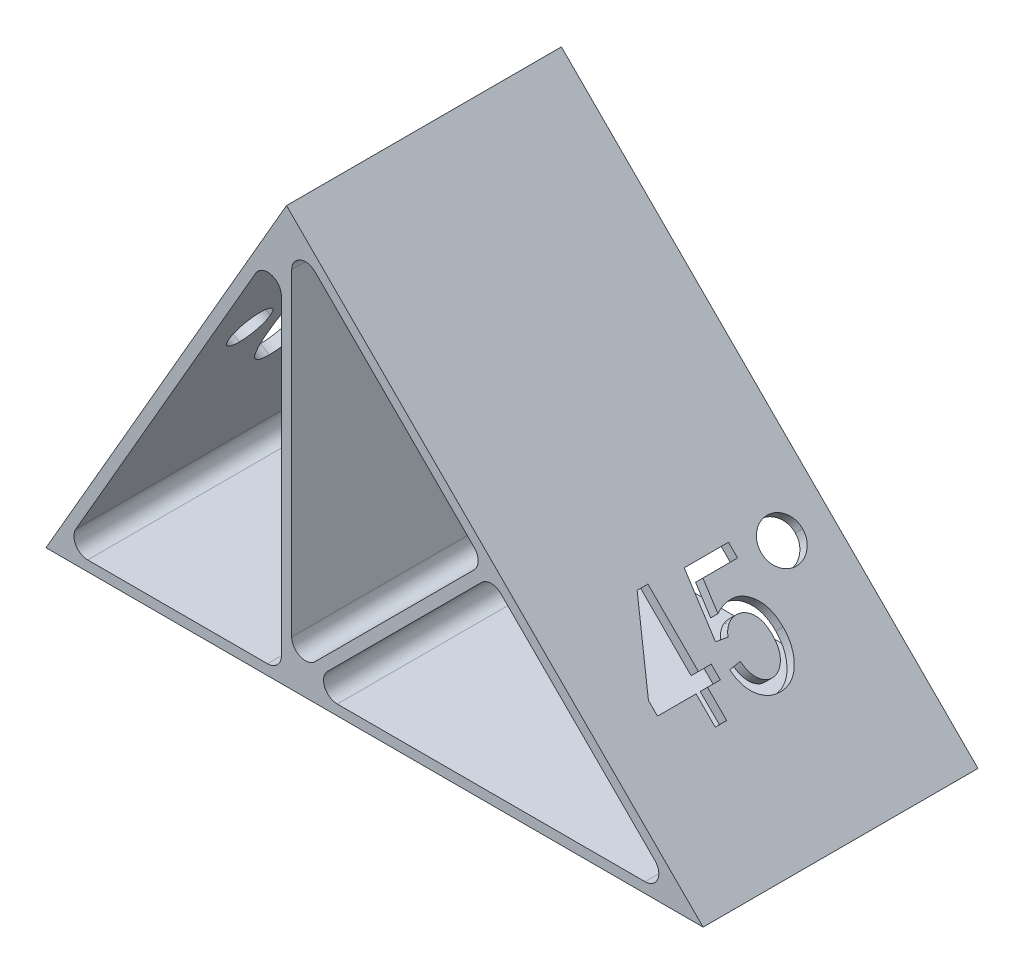
from build123d import *

# Parameters (mm, degrees)
BOSS_EXTRU_1_DEPTH      = 10
ENL_V_MAT_EXTRU_1_REACH = 39.364
ENL_V_MAT_EXTRU_2_DEPTH = 0.75
ENL_V_MAT_EXTRU_3_REACH = 52.035
CONG_1_R                = 1


with BuildPart() as part:
    # Esquisse1 → Boss.-Extru.1 (new, symmetric)
    with BuildSketch(Plane.XY):
        Polygon((-17.5, 0), (0, 30.310889132), (30.310889132, 0), align=None)
        Polygon((-16.200961894, 0.75), (-0.375, 28.16137008), (-0.375, 0.75), align=None, mode=Mode.SUBTRACT)
        Polygon((0.375, 28.875228961), (14.359949437, 14.890279523), (0.375, 0.905330086), align=None, mode=Mode.SUBTRACT)
        Polygon((28.500228961, 0.75), (1.280330086, 0.75), (14.890279523, 14.359949437), align=None, mode=Mode.SUBTRACT)
    extrude(amount=BOSS_EXTRU_1_DEPTH, both=True)

    # Esquisse2 → Enlèv. mat.-Extru.1 (cut, up to next)
    with BuildSketch(Plane(origin=(15.155444566, 15.155444566, 0), x_dir=(0, 0, -1), z_dir=(0.7071067811865437, 0.7071067811865513, 0)), mode=Mode.PRIVATE) as enl_v_mat_extru_1_sk1:
        Polygon((-3.035466988, -12.833518709), (-3.035466988, -10.859492735), (-5.840661794, -10.859492735), (-5.840661794, -9.9244278), (-2.988389066, -4.729622605), (-2.204298157, -4.729622605), (-2.204298157, -9.9244278), (-1.269233222, -9.9244278), (-1.269233222, -10.859492735), (-2.204298157, -10.859492735), (-2.204298157, -12.833518709), align=None)
        Polygon((-3.035466988, -9.9244278), (-3.035466988, -6.30916806), (-5.020856599, -9.9244278), align=None, mode=Mode.SUBTRACT)
    enl_v_mat_extru_1_tool1 = extrude(enl_v_mat_extru_1_sk1.sketch, amount=-ENL_V_MAT_EXTRU_1_REACH, mode=Mode.PRIVATE) & part.part
    # Esquisse2 → Enlèv. mat.-Extru.1 (cut, up to next)
    with BuildSketch(Plane(origin=(15.155444566, 15.155444566, 0), x_dir=(0, 0, -1), z_dir=(0.7071067811865437, 0.7071067811865513, 0)), mode=Mode.PRIVATE) as enl_v_mat_extru_1_sk2:
        with BuildLine():
            Line((-0.438064391, -10.651700527), (0.39310444, -10.547804423))
            add(Edge.make_bspline(
                [(0.39310444, -10.547804423), (0.401540786, -10.611244993), (0.41798176, -10.734879659), (0.454595352, -10.912857598), (0.494979853, -11.079626019), (0.5489008, -11.23190873), (0.603602516, -11.374599866), (0.671225322, -11.502446684), (0.743605704, -11.619229781), (0.825852321, -11.721144257), (0.911263998, -11.812845156), (1.002246834, -11.890432094), (1.096419219, -11.956504002), (1.193187466, -12.012068952), (1.294570265, -12.054769031), (1.399421614, -12.083670616), (1.50716682, -12.102277889), (1.58025807, -12.104915424), (1.617130414, -12.106245982)],
                knots=[0, 0, 0, 0, 1.411223046, 2.750228965, 4.006672634, 5.191927097, 6.311278306, 7.373684419, 8.377051755, 9.337097037, 10.257438676, 11.13782359, 11.969011532, 12.792190119, 13.594685164, 14.388253401, 15.186922146, 16, 16, 16, 16], degree=3))
            add(Edge.make_bspline(
                [(1.617130414, -12.106245982), (1.663241583, -12.104738429), (1.754496571, -12.101754949), (1.888600595, -12.076305406), (2.018355271, -12.0361345), (2.141764485, -11.97629319), (2.261368004, -11.902969254), (2.376021974, -11.812808273), (2.483932026, -11.704814401), (2.587910203, -11.583325277), (2.684117491, -11.448108857), (2.764474723, -11.29719988), (2.834348787, -11.135926597), (2.893739442, -10.963193876), (2.93664195, -10.777539332), (2.966767804, -10.580501216), (2.987185691, -10.371821125), (2.989379206, -10.228591283), (2.990507038, -10.154947281)],
                knots=[0, 0, 0, 0, 0.833557162, 1.649627401, 2.46080936, 3.284070299, 4.12358479, 4.995082037, 5.915776015, 6.88098611, 7.885890802, 8.910954604, 9.967600199, 11.063514457, 12.210406555, 13.409466691, 14.668034258, 16, 16, 16, 16], degree=3))
            add(Edge.make_bspline(
                [(2.990507038, -10.154947281), (2.989220567, -10.086181722), (2.986714043, -9.952200756), (2.968427838, -9.757003635), (2.940191977, -9.573366447), (2.898125579, -9.401548775), (2.842067508, -9.242525328), (2.77831427, -9.093570358), (2.69957344, -8.957526921), (2.608469938, -8.835089425), (2.510443521, -8.72430933), (2.403421006, -8.629457724), (2.291577199, -8.548229084), (2.173769227, -8.47963336), (2.047769756, -8.430803823), (1.917271225, -8.391828635), (1.779560938, -8.371388618), (1.685909669, -8.367808688), (1.63823431, -8.365986242)],
                knots=[0, 0, 0, 0, 1.312040837, 2.556345105, 3.737883698, 4.854849349, 5.925960309, 6.952388988, 7.9424386, 8.917239489, 9.860521384, 10.760061641, 11.639947922, 12.495504232, 13.352616949, 14.212152034, 15.089854369, 16, 16, 16, 16], degree=3))
            add(Edge.make_bspline(
                [(1.63823431, -8.365986242), (1.580665066, -8.36848876), (1.465820267, -8.37348103), (1.296227569, -8.41393753), (1.133343402, -8.481658501), (0.97752942, -8.572598848), (0.832565861, -8.686097808), (0.703663334, -8.823073239), (0.588722578, -8.97919282), (0.527970347, -9.095604058), (0.497000544, -9.154947281)],
                knots=[0, 0, 0, 0, 0.943378558, 1.881944462, 2.841095037, 3.827409543, 4.832274565, 5.849176661, 6.903569879, 8, 8, 8, 8], degree=3))
            Line((0.497000544, -9.154947281), (-0.334168287, -9.036440787))
            Line((-0.334168287, -9.036440787), (0.289208336, -4.937414813))
            Line((0.289208336, -4.937414813), (3.509987557, -4.937414813))
            Line((3.509987557, -4.937414813), (3.509987557, -5.872479748))
            Line((3.509987557, -5.872479748), (0.985636908, -5.872479748))
            Line((0.985636908, -5.872479748), (0.685312232, -7.848129099))
            add(Edge.make_bspline(
                [(0.685312232, -7.848129099), (0.778945424, -7.800244303), (0.964253106, -7.705476409), (1.2591026, -7.606781888), (1.562116088, -7.545877964), (1.767278978, -7.538516622), (1.870377167, -7.53481741)],
                knots=[0, 0, 0, 0, 1.017619267, 2.013951072, 3.001973272, 4, 4, 4, 4], degree=3))
            add(Edge.make_bspline(
                [(1.870377167, -7.53481741), (1.934907813, -7.537092862), (2.063160241, -7.541615245), (2.251688716, -7.575030612), (2.43401367, -7.628519779), (2.609285031, -7.706120608), (2.777594632, -7.805426445), (2.940201972, -7.925665071), (3.096319989, -8.067057918), (3.242621136, -8.231012897), (3.378986532, -8.411379582), (3.498041125, -8.609413218), (3.599083725, -8.822438479), (3.67926162, -9.051473946), (3.74530827, -9.294209042), (3.789911886, -9.552913673), (3.815556193, -9.826502702), (3.81960344, -10.013658122), (3.821675869, -10.109492735)],
                knots=[0, 0, 0, 0, 0.861018809, 1.711245113, 2.547675859, 3.391805506, 4.262674834, 5.151129072, 6.086914488, 7.068866089, 8.080081396, 9.100796714, 10.1476286, 11.221399762, 12.335728169, 13.501851446, 14.720800604, 16, 16, 16, 16], degree=3))
            add(Edge.make_bspline(
                [(3.821675869, -10.109492735), (3.819699814, -10.204792093), (3.815806664, -10.392547364), (3.788198123, -10.668842982), (3.740811957, -10.934598423), (3.675807809, -11.190184564), (3.593576998, -11.436061403), (3.49056137, -11.671124014), (3.368501786, -11.895136274), (3.230094817, -12.107241468), (3.075799506, -12.300806895), (2.907883631, -12.472300755), (2.725056582, -12.615390111), (2.530308029, -12.733953669), (2.322303937, -12.825519443), (2.101359807, -12.890341469), (1.867501078, -12.930385958), (1.707119662, -12.935039333), (1.625247297, -12.937414813)],
                knots=[0, 0, 0, 0, 1.144340564, 2.254537473, 3.330370625, 4.383172833, 5.418849903, 6.440219285, 7.460844228, 8.47914966, 9.47775429, 10.428908251, 11.354479858, 12.258284926, 13.160219244, 14.07516849, 15.0174017, 16, 16, 16, 16], degree=3))
            add(Edge.make_bspline(
                [(1.625247297, -12.937414813), (1.556975889, -12.935459693), (1.422573283, -12.931610744), (1.224999771, -12.903660176), (1.035584622, -12.856570999), (0.854207595, -12.789741451), (0.681673325, -12.702808127), (0.516334847, -12.59858834), (0.360538063, -12.474093537), (0.212485987, -12.333044508), (0.076447528, -12.174662086), (-0.043886577, -11.999472565), (-0.149949849, -11.810666676), (-0.239338543, -11.606684452), (-0.311719311, -11.388446353), (-0.370263675, -11.15625981), (-0.414764071, -10.909503111), (-0.430175544, -10.738985392), (-0.438064391, -10.651700527)],
                knots=[0, 0, 0, 0, 0.958587677, 1.88712499, 2.795765124, 3.694982091, 4.595578744, 5.504218877, 6.434682167, 7.391400486, 8.372260331, 9.360890354, 10.371359061, 11.409147611, 12.483330096, 13.596558593, 14.769722824, 16, 16, 16, 16], degree=3))
        make_face()
    enl_v_mat_extru_1_tool2 = extrude(enl_v_mat_extru_1_sk2.sketch, amount=-ENL_V_MAT_EXTRU_1_REACH, mode=Mode.PRIVATE) & part.part
    # Esquisse2 → Enlèv. mat.-Extru.1 (cut, up to next)
    with BuildSketch(Plane(origin=(15.155444566, 15.155444566, 0), x_dir=(0, 0, -1), z_dir=(0.7071067811865437, 0.7071067811865513, 0)), mode=Mode.PRIVATE) as enl_v_mat_extru_1_sk3:
        with BuildLine():
            add(Edge.make_bspline(
                [(4.964533012, -6.232869358), (4.965598539, -6.181921073), (4.967705118, -6.081194811), (4.989912161, -5.933436486), (5.023477871, -5.790675845), (5.072761029, -5.654423413), (5.134226159, -5.523285951), (5.211881195, -5.399632482), (5.30143589, -5.280150337), (5.404552661, -5.167998199), (5.516790336, -5.065089535), (5.63588893, -4.974544908), (5.761681758, -4.900037007), (5.892069798, -4.838061676), (6.027660145, -4.788276001), (6.169468941, -4.755231969), (6.316624792, -4.732672893), (6.416825938, -4.730650847), (6.467779765, -4.729622605)],
                knots=[0, 0, 0, 0, 1.033790096, 2.043833458, 3.027228292, 4.007302706, 4.980454208, 5.962313206, 6.966602655, 8.008767425, 9.050932194, 10.055221643, 11.040762626, 12.013914127, 12.98364789, 13.967042724, 14.966209904, 16, 16, 16, 16], degree=3))
            add(Edge.make_bspline(
                [(6.467779765, -4.729622605), (6.519268786, -4.730685769), (6.621071626, -4.732787831), (6.770439295, -4.755033285), (6.91434158, -4.788340094), (7.051202254, -4.837690728), (7.181978917, -4.900078532), (7.307793949, -4.974532187), (7.426875972, -5.06509819), (7.539158797, -5.167976064), (7.642112995, -5.280228615), (7.732076655, -5.399129951), (7.807528034, -5.523798875), (7.86940498, -5.654354186), (7.918544728, -5.790694495), (7.952149243, -5.933431358), (7.974345745, -6.081196143), (7.976453767, -6.18192152), (7.977520025, -6.232869358)],
                knots=[0, 0, 0, 0, 1.041641648, 2.059508501, 3.050612989, 4.027754557, 4.997993928, 5.980585705, 6.981869844, 8.020915963, 9.059962082, 10.061246221, 11.034449671, 12.004689042, 12.981830609, 13.96228266, 14.969303494, 16, 16, 16, 16], degree=3))
            add(Edge.make_bspline(
                [(7.977520025, -6.232869358), (7.976464278, -6.283819122), (7.974377036, -6.384548304), (7.951949883, -6.532806724), (7.918725667, -6.676146906), (7.869711673, -6.813412166), (7.805442754, -6.943945449), (7.728701488, -7.06935938), (7.639467639, -7.190297866), (7.535808967, -7.30253621), (7.423727049, -7.405653512), (7.304045489, -7.495790203), (7.17924036, -7.572455191), (7.047886514, -7.634424342), (6.911115825, -7.683939657), (6.767701164, -7.717005534), (6.619462839, -7.739475407), (6.518730915, -7.74155682), (6.467779765, -7.742609618)],
                knots=[0, 0, 0, 0, 1.029210758, 2.034779973, 3.024455786, 4.000188805, 4.973773238, 5.960603497, 6.969202704, 8.00675104, 9.044299375, 10.044140164, 11.030970423, 11.999811195, 12.975544214, 13.965220027, 14.970789242, 16, 16, 16, 16], degree=3))
            add(Edge.make_bspline(
                [(6.467779765, -7.742609618), (6.416825939, -7.741581376), (6.316624794, -7.739559329), (6.169468934, -7.717000258), (6.02766017, -7.683956208), (5.892069707, -7.634170603), (5.761682101, -7.572195005), (5.635887622, -7.49768812), (5.516795398, -7.407139573), (5.404532987, -7.304246133), (5.301508095, -7.192037448), (5.211347184, -7.072388627), (5.134689929, -6.947574777), (5.07271351, -6.816223955), (5.023219858, -6.679449687), (4.989952153, -6.535523777), (4.96769604, -6.386162547), (4.965595437, -6.284358826), (4.964533012, -6.232869358)],
                knots=[0, 0, 0, 0, 1.031089736, 2.027646995, 3.008473106, 3.97567383, 4.946283365, 5.929250019, 6.930916166, 7.970358701, 9.009801235, 10.011467382, 11.000099246, 11.970708781, 12.948223146, 13.939705759, 14.957960947, 16, 16, 16, 16], degree=3))
        make_face()
        with BuildLine():
            add(Edge.make_bspline(
                [(5.691805739, -6.236116112), (5.694538659, -6.28838044), (5.699872406, -6.390382961), (5.744342758, -6.53742623), (5.816539964, -6.672613121), (5.917338494, -6.790998219), (6.036633898, -6.890524495), (6.171294779, -6.962862532), (6.318394894, -7.007253724), (6.420389581, -7.012598381), (6.472649895, -7.015336891)],
                knots=[0, 0, 0, 0, 1.021783983, 1.994181231, 2.980339501, 4.003386608, 5.019660499, 6.005818769, 6.978216017, 8, 8, 8, 8], degree=3))
            add(Edge.make_bspline(
                [(6.472649895, -7.015336891), (6.524350395, -7.012528939), (6.625765841, -7.007020875), (6.772065296, -6.963272843), (6.905664334, -6.88998622), (7.024748198, -6.791061835), (7.125504391, -6.672596712), (7.197712518, -6.537430463), (7.24218004, -6.390381847), (7.247514178, -6.288380062), (7.250247297, -6.236116112)],
                knots=[0, 0, 0, 0, 1.013752191, 1.988571289, 2.96783755, 3.98664257, 5.012237674, 6.000852067, 6.975671165, 8, 8, 8, 8], degree=3))
            add(Edge.make_bspline(
                [(7.250247297, -6.236116112), (7.24749184, -6.183862879), (7.242114107, -6.081882012), (7.198101051, -5.935142184), (7.125040527, -5.800922432), (7.024277679, -5.682864816), (6.906220313, -5.582102515), (6.772000134, -5.509040139), (6.62578286, -5.465190256), (6.524356142, -5.459696162), (6.472649895, -5.456895333)],
                knots=[0, 0, 0, 0, 1.024656475, 1.999787376, 2.979366864, 4.005290014, 5.031213163, 6.010792651, 6.985923552, 8, 8, 8, 8], degree=3))
            add(Edge.make_bspline(
                [(6.472649895, -5.456895333), (6.420383755, -5.459626627), (6.318377697, -5.464957203), (6.171360087, -5.509450568), (6.036074165, -5.581558954), (5.917808804, -5.682928239), (5.817003999, -5.800906295), (5.743954195, -5.935146375), (5.699938345, -6.081880904), (5.694560999, -6.183862503), (5.691805739, -6.236116112)],
                knots=[0, 0, 0, 0, 1.022109997, 1.994817501, 2.981290418, 4.004663941, 5.028037464, 6.005182499, 6.977890003, 8, 8, 8, 8], degree=3))
        make_face(mode=Mode.SUBTRACT)
    enl_v_mat_extru_1_tool3 = extrude(enl_v_mat_extru_1_sk3.sketch, amount=-ENL_V_MAT_EXTRU_1_REACH, mode=Mode.PRIVATE) & part.part
    add(enl_v_mat_extru_1_tool1.solids().sort_by_distance((23.532189, 6.7787, 2.942423))[0], mode=Mode.SUBTRACT)
    add(enl_v_mat_extru_1_tool2.solids().sort_by_distance((22.714195, 7.596695, 0.011238))[0], mode=Mode.SUBTRACT)
    add(enl_v_mat_extru_1_tool3.solids().sort_by_distance((18.832826, 11.478063, -5.435305))[0], mode=Mode.SUBTRACT)


with BuildPart() as enl_v_mat_extru_1_piece_1:
    # of the separate pieces the step leaves, piece 1, a body of its own (enl_v_mat_extru_1_pieces)
    add(part.part.solids().sort_by_distance((-17.5, 0, -10))[0])

    # Esquisse4 → Enlèv. mat.-Extru.3 (cut, up to next)
    with BuildSketch(Plane(origin=(-13.125, 7.577722283, 0), x_dir=(0, 0, 1), z_dir=(-0.866025403784436, 0.5000000000000043, 0)), mode=Mode.PRIVATE) as enl_v_mat_extru_3_sk1:
        with BuildLine():
            Line((-1.749093416, 11.311725682), (-2.580262248, 11.207829578))
            add(Edge.make_bspline(
                [(-2.580262248, 11.207829578), (-2.599474661, 11.302491044), (-2.635450712, 11.479748623), (-2.713482354, 11.719876478), (-2.800424023, 11.920646506), (-2.880824235, 12.027177691), (-2.917924585, 12.076336071)],
                knots=[0, 0, 0, 0, 1.230211225, 2.30362229, 3.217213433, 4, 4, 4, 4], degree=3))
            add(Edge.make_bspline(
                [(-2.917924585, 12.076336071), (-2.944904671, 12.106704889), (-2.997365306, 12.165754645), (-3.084555103, 12.242245607), (-3.174324139, 12.308168311), (-3.268728071, 12.362448188), (-3.368879741, 12.403030907), (-3.472914748, 12.432078362), (-3.58069551, 12.450596584), (-3.653781943, 12.453246182), (-3.690651858, 12.454582825)],
                knots=[0, 0, 0, 0, 1.09495211, 2.12904747, 3.12182315, 4.09596367, 5.058329339, 6.028853599, 7.005615717, 8, 8, 8, 8], degree=3))
            add(Edge.make_bspline(
                [(-3.690651858, 12.454582825), (-3.747769397, 12.452463596), (-3.860930736, 12.448264977), (-4.025151593, 12.402999689), (-4.181489627, 12.335031619), (-4.327758136, 12.236730561), (-4.464236112, 12.111573044), (-4.593828012, 11.960739631), (-4.711659863, 11.780767959), (-4.780063271, 11.648433265), (-4.815651858, 11.579582825)],
                knots=[0, 0, 0, 0, 0.906800098, 1.796553483, 2.691003266, 3.610512055, 4.585978966, 5.630213089, 6.767058994, 8, 8, 8, 8], degree=3))
            add(Edge.make_bspline(
                [(-4.815651858, 11.579582825), (-4.845520804, 11.513496565), (-4.907618995, 11.376101789), (-4.980438501, 11.152202267), (-5.044429608, 10.906806047), (-5.092411171, 10.637770428), (-5.136034204, 10.347882916), (-5.163847702, 10.034563334), (-5.182025772, 9.699388983), (-5.184505096, 9.468137443), (-5.185781728, 9.349063344)],
                knots=[0, 0, 0, 0, 0.763508889, 1.587351645, 2.476402758, 3.433472996, 4.464603951, 5.563935012, 6.745641893, 8, 8, 8, 8], degree=3))
            add(Edge.make_bspline(
                [(-5.185781728, 9.349063344), (-5.138719979, 9.430089469), (-5.047147002, 9.587750489), (-4.876506983, 9.79432601), (-4.693545092, 9.974357631), (-4.490375877, 10.119016612), (-4.27591802, 10.232514245), (-4.054348507, 10.316624306), (-3.825515276, 10.367369795), (-3.670878615, 10.373555468), (-3.593249261, 10.376660747)],
                knots=[0, 0, 0, 0, 1.127907175, 2.194687167, 3.21896757, 4.214740698, 5.189497801, 6.137088422, 7.064797308, 8, 8, 8, 8], degree=3))
            add(Edge.make_bspline(
                [(-3.593249261, 10.376660747), (-3.528720509, 10.374416079), (-3.401538479, 10.369991983), (-3.213861402, 10.336511409), (-3.033193306, 10.280834394), (-2.857857276, 10.204262701), (-2.689596095, 10.103564459), (-2.527215362, 9.981915989), (-2.372752689, 9.836802328), (-2.223503485, 9.674550604), (-2.088017062, 9.491782551), (-1.969184547, 9.292673794), (-1.867782624, 9.079310018), (-1.787301077, 8.849802193), (-1.722042418, 8.606878598), (-1.676743316, 8.348326524), (-1.651362398, 8.075226186), (-1.647285119, 7.888076724), (-1.645197312, 7.792245162)],
                knots=[0, 0, 0, 0, 0.860357646, 1.695709716, 2.533583491, 3.377064945, 4.241047709, 5.143225219, 6.077846286, 7.063889573, 8.080111547, 9.106229702, 10.152257742, 11.225204373, 12.345649275, 13.503769734, 14.721782881, 16, 16, 16, 16], degree=3))
            add(Edge.make_bspline(
                [(-1.645197312, 7.792245162), (-1.648511599, 7.662194459), (-1.655003931, 7.407439121), (-1.709418579, 7.034439811), (-1.801029882, 6.680611955), (-1.904866451, 6.400189234), (-2.004612035, 6.189991147), (-2.084478542, 6.043224234), (-2.168562242, 5.906887544), (-2.257587911, 5.780747331), (-2.354262249, 5.66774568), (-2.453285193, 5.562361007), (-2.558628991, 5.468338627), (-2.704634611, 5.359215477), (-2.896689064, 5.246453708), (-3.14202934, 5.149895918), (-3.398721689, 5.088862694), (-3.574516193, 5.08161149), (-3.663054455, 5.077959448)],
                knots=[0, 0, 0, 0, 1.657459496, 3.246784879, 4.79287916, 6.310074839, 7.050696599, 7.757650882, 8.439205885, 9.092012499, 9.723586031, 10.333538589, 10.934530017, 11.52093132, 12.655638276, 13.761218907, 14.872446044, 16, 16, 16, 16], degree=3))
            add(Edge.make_bspline(
                [(-3.663054455, 5.077959448), (-3.742805171, 5.080746558), (-3.899663268, 5.086228399), (-4.129188404, 5.130292871), (-4.348724443, 5.199248231), (-4.555824556, 5.300770004), (-4.755018847, 5.425650265), (-4.939377991, 5.583675137), (-5.114491942, 5.767447358), (-5.279720531, 5.978971099), (-5.428317881, 6.225487195), (-5.55797002, 6.507907077), (-5.666288794, 6.828484387), (-5.751636718, 7.186454704), (-5.82164277, 7.581004491), (-5.870858838, 8.012517824), (-5.899830505, 8.481777937), (-5.903191391, 8.806812105), (-5.904937572, 8.975686721)],
                knots=[0, 0, 0, 0, 0.760819453, 1.496421576, 2.223429687, 2.951263266, 3.692179274, 4.462099387, 5.262291211, 6.1127328, 7.019077074, 8.003719522, 9.073773746, 10.244022616, 11.513769144, 12.897217303, 14.387919526, 16, 16, 16, 16], degree=3))
            add(Edge.make_bspline(
                [(-5.904937572, 8.975686721), (-5.903400591, 9.162968288), (-5.900439834, 9.523737203), (-5.868658216, 10.04419912), (-5.820569266, 10.522939571), (-5.748949974, 10.959773351), (-5.660082235, 11.355404642), (-5.548261275, 11.708981541), (-5.418470464, 12.022050107), (-5.264057828, 12.292592201), (-5.093824228, 12.526108401), (-4.913429248, 12.728677214), (-4.722384456, 12.901789661), (-4.518619574, 13.042945838), (-4.301598375, 13.150614338), (-4.074527007, 13.229958169), (-3.834803878, 13.275898665), (-3.671362447, 13.28243367), (-3.588379131, 13.285751656)],
                knots=[0, 0, 0, 0, 1.648816343, 3.176189159, 4.589499976, 5.883521052, 7.071677735, 8.156616623, 9.145117633, 10.049911772, 10.892392766, 11.685345428, 12.434380955, 13.15730553, 13.86047472, 14.561137348, 15.269453316, 16, 16, 16, 16], degree=3))
            add(Edge.make_bspline(
                [(-3.588379131, 13.285751656), (-3.528259541, 13.284036265), (-3.409752082, 13.280654896), (-3.235364631, 13.258574465), (-3.069356402, 13.217030195), (-2.910185273, 13.162020414), (-2.759368206, 13.089949743), (-2.614586255, 13.004058207), (-2.480280214, 12.898445852), (-2.351718612, 12.780474648), (-2.232769243, 12.647377667), (-2.127026964, 12.498239714), (-2.033253134, 12.335408618), (-1.949342555, 12.158939424), (-1.880391843, 11.967306136), (-1.824022033, 11.761436688), (-1.777686845, 11.541994498), (-1.758791532, 11.389826615), (-1.749093416, 11.311725682)],
                knots=[0, 0, 0, 0, 0.965625992, 1.903437499, 2.816107718, 3.709373219, 4.603483816, 5.496241877, 6.407089735, 7.341876361, 8.295975248, 9.267838192, 10.27248647, 11.310449055, 12.401896837, 13.538363143, 14.736552469, 16, 16, 16, 16], degree=3))
        make_face()
        with BuildLine():
            add(Edge.make_bspline(
                [(-5.073768741, 7.823089318), (-5.072581993, 7.75269838), (-5.070267602, 7.615422231), (-5.050493577, 7.414653036), (-5.017853329, 7.224954245), (-4.975038413, 7.044635593), (-4.915791186, 6.876264592), (-4.846458456, 6.716752551), (-4.761515458, 6.569500359), (-4.666049194, 6.43298783), (-4.561767686, 6.311044852), (-4.451739747, 6.204305948), (-4.338971993, 6.112681501), (-4.220148826, 6.039157312), (-4.098422513, 5.979226174), (-3.970754178, 5.93931716), (-3.839949519, 5.913688115), (-3.751377129, 5.910652915), (-3.706885624, 5.909128279)],
                knots=[0, 0, 0, 0, 1.295936842, 2.527331243, 3.710032566, 4.838610101, 5.935196688, 6.992417297, 8.036740745, 9.059547266, 10.056000021, 10.986130286, 11.879343137, 12.725347321, 13.554280309, 14.370418864, 15.181432095, 16, 16, 16, 16], degree=3))
            add(Edge.make_bspline(
                [(-3.706885624, 5.909128279), (-3.66729144, 5.910834184), (-3.588538082, 5.91422725), (-3.472397405, 5.937045713), (-3.360639907, 5.977556484), (-3.250971114, 6.030852216), (-3.145645816, 6.101955774), (-3.042291896, 6.186225909), (-2.945671222, 6.289003845), (-2.849200516, 6.402619159), (-2.762922509, 6.532826783), (-2.683536076, 6.673331987), (-2.621762348, 6.828092421), (-2.566836124, 6.991852771), (-2.527812345, 7.168910867), (-2.495675109, 7.356148779), (-2.480881357, 7.556082064), (-2.477901323, 7.692663683), (-2.476366144, 7.763024383)],
                knots=[0, 0, 0, 0, 0.772594522, 1.536700729, 2.298102904, 3.086693685, 3.909598938, 4.772126543, 5.683120767, 6.657848237, 7.676972593, 8.726121203, 9.800678132, 10.92259173, 12.09308983, 13.334225679, 14.626713094, 16, 16, 16, 16], degree=3))
            add(Edge.make_bspline(
                [(-2.476366144, 7.763024383), (-2.477844316, 7.831771076), (-2.480711739, 7.965128965), (-2.496255128, 8.16000308), (-2.525675815, 8.34272754), (-2.565109478, 8.514286427), (-2.619965978, 8.672161945), (-2.682350258, 8.819875064), (-2.759287061, 8.955014936), (-2.846860714, 9.07799886), (-2.941742312, 9.188139834), (-3.043865539, 9.28344526), (-3.150033636, 9.364784756), (-3.262633311, 9.430495566), (-3.379172389, 9.483499152), (-3.502986069, 9.518310175), (-3.630706262, 9.542686016), (-3.718132286, 9.544553268), (-3.762080429, 9.545491916)],
                knots=[0, 0, 0, 0, 1.343777819, 2.606719898, 3.816838752, 4.958326899, 6.041908764, 7.079242616, 8.08798765, 9.073968097, 10.026073332, 10.923948235, 11.799625043, 12.633965371, 13.467232591, 14.293828985, 15.142325764, 16, 16, 16, 16], degree=3))
            add(Edge.make_bspline(
                [(-3.762080429, 9.545491916), (-3.805495132, 9.544592079), (-3.891328568, 9.54281305), (-4.016831077, 9.51810742), (-4.138984463, 9.483282765), (-4.255711121, 9.429762126), (-4.370047871, 9.365169789), (-4.479924356, 9.284929685), (-4.582945628, 9.187766337), (-4.683887768, 9.080068335), (-4.775830038, 8.959143113), (-4.855830151, 8.826917427), (-4.922262666, 8.684547174), (-4.977730403, 8.532494368), (-5.021747823, 8.369662387), (-5.051910757, 8.196314857), (-5.069911997, 8.012863949), (-5.072459227, 7.887525178), (-5.073768741, 7.823089318)],
                knots=[0, 0, 0, 0, 0.863470541, 1.707132358, 2.539352989, 3.38871181, 4.257816365, 5.15261427, 6.090962397, 7.075009843, 8.09049846, 9.111009759, 10.147788812, 11.215218178, 12.331811356, 13.503305971, 14.716465586, 16, 16, 16, 16], degree=3))
        make_face(mode=Mode.SUBTRACT)
    enl_v_mat_extru_3_tool1 = extrude(enl_v_mat_extru_3_sk1.sketch, amount=-ENL_V_MAT_EXTRU_3_REACH, mode=Mode.PRIVATE) & enl_v_mat_extru_1_piece_1.part
    # Esquisse4 → Enlèv. mat.-Extru.3 (cut, up to next)
    with BuildSketch(Plane(origin=(-13.125, 7.577722283, 0), x_dir=(0, 0, 1), z_dir=(-0.866025403784436, 0.5000000000000043, 0)), mode=Mode.PRIVATE) as enl_v_mat_extru_3_sk2:
        with BuildLine():
            add(Edge.make_bspline(
                [(-0.814028481, 9.178608799), (-0.812708613, 9.342065908), (-0.810145747, 9.659460303), (-0.783659071, 10.119804937), (-0.741881743, 10.549869098), (-0.685070215, 10.949076117), (-0.608182504, 11.31748593), (-0.517639543, 11.655689594), (-0.40643473, 11.962611588), (-0.281266847, 12.239567976), (-0.137728068, 12.485012311), (0.020517361, 12.699788021), (0.198163584, 12.880409301), (0.390312211, 13.030602929), (0.600785795, 13.145024183), (0.826588627, 13.22725641), (1.068555429, 13.276878689), (1.235520989, 13.282753932), (1.320711778, 13.285751656)],
                knots=[0, 0, 0, 0, 1.522295809, 2.955932353, 4.292935845, 5.545987552, 6.709403679, 7.796379217, 8.803980711, 9.746667296, 10.623167879, 11.447716403, 12.224665142, 12.975696349, 13.710987297, 14.4460191, 15.207112772, 16, 16, 16, 16], degree=3))
            add(Edge.make_bspline(
                [(1.320711778, 13.285751656), (1.396630379, 13.283316236), (1.545717135, 13.278533629), (1.763272423, 13.239093562), (1.967897228, 13.171996777), (2.159746109, 13.078752233), (2.338236304, 12.958365136), (2.505123929, 12.812802113), (2.658580167, 12.639128306), (2.747439772, 12.508658446), (2.793114376, 12.441595812)],
                knots=[0, 0, 0, 0, 1.02435884, 2.0116063, 2.972586715, 3.92329494, 4.881606269, 5.870473939, 6.905405214, 8, 8, 8, 8], degree=3))
            add(Edge.make_bspline(
                [(2.793114376, 12.441595812), (2.845984034, 12.351180192), (2.955932065, 12.163151372), (3.087215349, 11.848113214), (3.197875046, 11.496242041), (3.291178804, 11.106417981), (3.357734509, 10.677837243), (3.41040927, 10.212166957), (3.440894837, 9.70823662), (3.444067623, 9.359385475), (3.445711778, 9.178608799)],
                knots=[0, 0, 0, 0, 0.745747152, 1.550859881, 2.42529298, 3.372802996, 4.404287875, 5.514077945, 6.711780846, 8, 8, 8, 8], degree=3))
            add(Edge.make_bspline(
                [(3.445711778, 9.178608799), (3.44440791, 9.016231863), (3.441876604, 8.700996358), (3.415124864, 8.242844076), (3.373904161, 7.814869763), (3.316321002, 7.416880319), (3.240146353, 7.049374968), (3.148400333, 6.71126327), (3.040666071, 6.402694942), (2.913765597, 6.125709024), (2.772339831, 5.878832682), (2.611409949, 5.6662334), (2.438045006, 5.482383806), (2.243402196, 5.335443348), (2.034364715, 5.217783403), (1.807040091, 5.136937151), (1.564266716, 5.086619376), (1.39672237, 5.08089119), (1.310971519, 5.077959448)],
                knots=[0, 0, 0, 0, 1.513874866, 2.939007974, 4.277477108, 5.521918538, 6.686610019, 7.774777114, 8.786532326, 9.730252297, 10.61206932, 11.433487149, 12.211385775, 12.960169701, 13.698700869, 14.439280195, 15.201208188, 16, 16, 16, 16], degree=3))
            add(Edge.make_bspline(
                [(1.310971519, 5.077959448), (1.234488393, 5.080830145), (1.084113961, 5.086474258), (0.863475106, 5.129387451), (0.654652468, 5.20337774), (0.456542967, 5.305028867), (0.268883238, 5.434988943), (0.093966141, 5.595995435), (-0.072434375, 5.783810101), (-0.228317004, 6.001895507), (-0.36918068, 6.255857556), (-0.488255718, 6.551740973), (-0.589704, 6.888132428), (-0.670208121, 7.266390009), (-0.737968399, 7.68496767), (-0.780553129, 8.145964864), (-0.808778797, 8.648492005), (-0.812232879, 8.997287659), (-0.814028481, 9.178608799)],
                knots=[0, 0, 0, 0, 0.713782411, 1.403376538, 2.088831486, 2.775699897, 3.476400496, 4.213162367, 4.989742879, 5.815463779, 6.710980744, 7.6941898, 8.787315853, 9.987366569, 11.302150399, 12.743876293, 14.307306722, 16, 16, 16, 16], degree=3))
        make_face()
        with BuildLine():
            add(Edge.make_bspline(
                [(0.01714035, 9.181855552), (0.018589653, 9.026000245), (0.021358252, 8.728270346), (0.036573325, 8.301023663), (0.065331289, 7.914364371), (0.105273165, 7.567074152), (0.155912891, 7.260587566), (0.218413967, 6.993217181), (0.29289013, 6.76605017), (0.380511354, 6.575852103), (0.47767722, 6.417963262), (0.581462894, 6.283423307), (0.68877404, 6.166741325), (0.806079717, 6.073536087), (0.927865065, 5.998173088), (1.058836072, 5.948998552), (1.194372898, 5.913504731), (1.288007938, 5.910597378), (1.335322168, 5.909128279)],
                knots=[0, 0, 0, 0, 1.930873368, 3.688541263, 5.295281011, 6.732986767, 8.018032389, 9.141589856, 10.131594649, 10.974379403, 11.729767228, 12.422984227, 13.077418253, 13.687793181, 14.274134012, 14.843047171, 15.415386244, 16, 16, 16, 16], degree=3))
            add(Edge.make_bspline(
                [(1.335322168, 5.909128279), (1.379922964, 5.91066863), (1.468730246, 5.913735714), (1.598183277, 5.948867164), (1.722981958, 6.000401084), (1.841028879, 6.074983808), (1.952154521, 6.170911716), (2.057864995, 6.287376881), (2.158317697, 6.424507342), (2.25464582, 6.584763804), (2.341336097, 6.775928131), (2.415072811, 7.004174615), (2.477118233, 7.271459231), (2.528440912, 7.57778631), (2.565622582, 7.92370343), (2.595390288, 8.308027445), (2.610210328, 8.732066195), (2.613057327, 9.027626432), (2.614542947, 9.181855552)],
                knots=[0, 0, 0, 0, 0.556098029, 1.107279675, 1.665020537, 2.239289732, 2.843790749, 3.494855459, 4.20099618, 4.965402842, 5.827994078, 6.818278647, 7.958442113, 9.254955883, 10.697998423, 12.305588537, 14.072183745, 16, 16, 16, 16], degree=3))
            add(Edge.make_bspline(
                [(2.614542947, 9.181855552), (2.613063938, 9.337709003), (2.610228329, 9.636516784), (2.595340684, 10.064328696), (2.566060914, 10.452015693), (2.526825702, 10.798874796), (2.475215306, 11.105696039), (2.413952091, 11.372879771), (2.338258193, 11.599589689), (2.251881312, 11.78940838), (2.152737763, 11.945892652), (2.051510197, 12.082474683), (1.940579436, 12.196269778), (1.823979223, 12.291026116), (1.700011404, 12.364863702), (1.568131982, 12.417626641), (1.429366301, 12.44937685), (1.334402512, 12.452840212), (1.286620869, 12.454582825)],
                knots=[0, 0, 0, 0, 1.926173374, 3.692928135, 5.28908838, 6.72993665, 8.005261178, 9.132588719, 10.113846285, 10.954579593, 11.702439438, 12.399284011, 13.051919516, 13.660808713, 14.251466784, 14.827675714, 15.41013748, 16, 16, 16, 16], degree=3))
            add(Edge.make_bspline(
                [(1.286620869, 12.454582825), (1.242012809, 12.453083166), (1.153716817, 12.450114781), (1.025340108, 12.414835262), (0.902181646, 12.363250688), (0.784999477, 12.288336207), (0.675272252, 12.191056399), (0.56870453, 12.075312569), (0.470454895, 11.936945387), (0.373773532, 11.778155995), (0.288603485, 11.586480386), (0.214752374, 11.358630953), (0.155354786, 11.090866847), (0.102867429, 10.78546152), (0.066160895, 10.439986455), (0.036262085, 10.055690209), (0.021481859, 9.631643026), (0.018629018, 9.336084026), (0.01714035, 9.181855552)],
                knots=[0, 0, 0, 0, 0.557102101, 1.102712893, 1.655222221, 2.224793741, 2.834805151, 3.487045402, 4.190458401, 4.956245252, 5.811421647, 6.809929224, 7.950602775, 9.242777249, 10.688425301, 12.298918027, 14.068702942, 16, 16, 16, 16], degree=3))
        make_face(mode=Mode.SUBTRACT)
    enl_v_mat_extru_3_tool2 = extrude(enl_v_mat_extru_3_sk2.sketch, amount=-ENL_V_MAT_EXTRU_3_REACH, mode=Mode.PRIVATE) & enl_v_mat_extru_1_piece_1.part
    # Esquisse4 → Enlèv. mat.-Extru.3 (cut, up to next)
    with BuildSketch(Plane(origin=(-13.125, 7.577722283, 0), x_dir=(0, 0, 1), z_dir=(-0.866025403784436, 0.5000000000000043, 0)), mode=Mode.PRIVATE) as enl_v_mat_extru_3_sk3:
        with BuildLine():
            add(Edge.make_bspline(
                [(4.588568921, 11.782504903), (4.589634449, 11.833453189), (4.591741028, 11.93417945), (4.613948071, 12.081937775), (4.647513781, 12.224698417), (4.696796939, 12.360950848), (4.758262069, 12.49208831), (4.835917105, 12.61574178), (4.9254718, 12.735223924), (5.028588571, 12.847376062), (5.140826245, 12.950284726), (5.25992484, 13.040829353), (5.385717668, 13.115337254), (5.516105708, 13.177312585), (5.651696055, 13.227098261), (5.793504851, 13.260142292), (5.940660702, 13.282701368), (6.040861848, 13.284723414), (6.091815675, 13.285751656)],
                knots=[0, 0, 0, 0, 1.033790096, 2.043833458, 3.027228292, 4.007302706, 4.980454208, 5.962313206, 6.966602655, 8.008767425, 9.050932194, 10.055221643, 11.040762626, 12.013914127, 12.98364789, 13.967042724, 14.966209904, 16, 16, 16, 16], degree=3))
            add(Edge.make_bspline(
                [(6.091815675, 13.285751656), (6.143304696, 13.284688492), (6.245107535, 13.282586431), (6.394475205, 13.260340976), (6.53837749, 13.227034167), (6.675238164, 13.177683533), (6.806014826, 13.115295729), (6.931829859, 13.040842074), (7.050911882, 12.950276071), (7.163194706, 12.847398197), (7.266148905, 12.735145646), (7.356112564, 12.61624431), (7.431563944, 12.491575386), (7.49344089, 12.361020075), (7.542580637, 12.224679766), (7.576185153, 12.081942903), (7.598381654, 11.934178118), (7.600489677, 11.833452741), (7.601555934, 11.782504903)],
                knots=[0, 0, 0, 0, 1.041641648, 2.059508501, 3.050612989, 4.027754557, 4.997993928, 5.980585705, 6.981869844, 8.020915963, 9.059962082, 10.061246221, 11.034449671, 12.004689042, 12.981830609, 13.96228266, 14.969303494, 16, 16, 16, 16], degree=3))
            add(Edge.make_bspline(
                [(7.601555934, 11.782504903), (7.600500188, 11.731555139), (7.598412946, 11.630825957), (7.575985793, 11.482567537), (7.542761577, 11.339227355), (7.493747583, 11.201962095), (7.429478663, 11.071428812), (7.352737398, 10.946014882), (7.263503549, 10.825076395), (7.159844877, 10.712838051), (7.047762959, 10.609720749), (6.928081399, 10.519584058), (6.80327627, 10.44291907), (6.671922424, 10.380949919), (6.535151735, 10.331434604), (6.391737074, 10.298368727), (6.243498749, 10.275898854), (6.142766825, 10.273817441), (6.091815675, 10.272764643)],
                knots=[0, 0, 0, 0, 1.029210758, 2.034779973, 3.024455786, 4.000188805, 4.973773238, 5.960603497, 6.969202704, 8.00675104, 9.044299375, 10.044140164, 11.030970423, 11.999811195, 12.975544214, 13.965220027, 14.970789242, 16, 16, 16, 16], degree=3))
            add(Edge.make_bspline(
                [(6.091815675, 10.272764643), (6.040861849, 10.273792885), (5.940660704, 10.275814932), (5.793504844, 10.298374003), (5.651696079, 10.331418053), (5.516105617, 10.381203658), (5.385718011, 10.443179256), (5.259923532, 10.517686141), (5.140831307, 10.608234688), (5.028568897, 10.711128128), (4.925544005, 10.823336813), (4.835383094, 10.942985634), (4.758725839, 11.067799484), (4.69674942, 11.199150306), (4.647255768, 11.335924574), (4.613988063, 11.479850484), (4.591731949, 11.629211714), (4.589631347, 11.731015435), (4.588568921, 11.782504903)],
                knots=[0, 0, 0, 0, 1.031089736, 2.027646995, 3.008473106, 3.97567383, 4.946283365, 5.929250019, 6.930916166, 7.970358701, 9.009801235, 10.011467382, 11.000099246, 11.970708781, 12.948223146, 13.939705759, 14.957960947, 16, 16, 16, 16], degree=3))
        make_face()
        with BuildLine():
            add(Edge.make_bspline(
                [(5.315841649, 11.779258149), (5.318574568, 11.726993821), (5.323908316, 11.6249913), (5.368378668, 11.477948032), (5.440575874, 11.34276114), (5.541374404, 11.224376042), (5.660669808, 11.124849766), (5.795330689, 11.052511729), (5.942430803, 11.008120537), (6.04442549, 11.00277588), (6.096685804, 11.00003737)],
                knots=[0, 0, 0, 0, 1.021783983, 1.994181231, 2.980339501, 4.003386608, 5.019660499, 6.005818769, 6.978216017, 8, 8, 8, 8], degree=3))
            add(Edge.make_bspline(
                [(6.096685804, 11.00003737), (6.148386305, 11.002845322), (6.249801751, 11.008353386), (6.396101206, 11.052101418), (6.529700244, 11.125388041), (6.648784108, 11.224312426), (6.7495403, 11.342777549), (6.821748427, 11.477943798), (6.86621595, 11.624992414), (6.871550087, 11.726994199), (6.874283207, 11.779258149)],
                knots=[0, 0, 0, 0, 1.013752191, 1.988571289, 2.96783755, 3.98664257, 5.012237674, 6.000852067, 6.975671165, 8, 8, 8, 8], degree=3))
            add(Edge.make_bspline(
                [(6.874283207, 11.779258149), (6.871527749, 11.831511382), (6.866150016, 11.93349225), (6.822136961, 12.080232077), (6.749076437, 12.214451829), (6.648313588, 12.332509445), (6.530256222, 12.433271746), (6.396036043, 12.506334122), (6.24981877, 12.550184005), (6.148392051, 12.555678099), (6.096685804, 12.558478929)],
                knots=[0, 0, 0, 0, 1.024656475, 1.999787376, 2.979366864, 4.005290014, 5.031213163, 6.010792651, 6.985923552, 8, 8, 8, 8], degree=3))
            add(Edge.make_bspline(
                [(6.096685804, 12.558478929), (6.044419664, 12.555747634), (5.942413607, 12.550417058), (5.795395996, 12.505923693), (5.660110075, 12.433815307), (5.541844713, 12.332446022), (5.441039909, 12.214467966), (5.367990104, 12.080227887), (5.323974255, 11.933493357), (5.318596908, 11.831511758), (5.315841649, 11.779258149)],
                knots=[0, 0, 0, 0, 1.022109997, 1.994817501, 2.981290418, 4.004663941, 5.028037464, 6.005182499, 6.977890003, 8, 8, 8, 8], degree=3))
        make_face(mode=Mode.SUBTRACT)
    enl_v_mat_extru_3_tool3 = extrude(enl_v_mat_extru_3_sk3.sketch, amount=-ENL_V_MAT_EXTRU_3_REACH, mode=Mode.PRIVATE) & enl_v_mat_extru_1_piece_1.part
    add(enl_v_mat_extru_3_tool1.solids().sort_by_distance((-7.449232, 17.408442, -2.176148))[0], mode=Mode.SUBTRACT)
    add(enl_v_mat_extru_3_tool2.solids().sort_by_distance((-7.27697, 17.706807, -0.402249))[0], mode=Mode.SUBTRACT)
    add(enl_v_mat_extru_3_tool3.solids().sort_by_distance((-6.717614, 18.67564, 5.059341))[0], mode=Mode.SUBTRACT)


with BuildPart() as enl_v_mat_extru_1_piece_2:
    # of the separate pieces the step leaves, piece 2, a body of its own (enl_v_mat_extru_1_pieces)
    add(part.part.solids().sort_by_distance((22.173074763, 8.137814369, 3.035466988))[0])


with BuildPart() as enl_v_mat_extru_1_piece_3:
    # of the separate pieces the step leaves, piece 3, a body of its own (enl_v_mat_extru_1_pieces)
    add(part.part.solids().sort_by_distance((19.565044557, 10.745844575, -5.691805739))[0])


with BuildPart() as enl_v_mat_extru_2_tool:
    # Esquisse3 → Enlèv. mat.-Extru.2 (new body)
    with BuildSketch(Plane(origin=(15.155444566, 15.155444566, 0), x_dir=(0, 0, -1), z_dir=(0.7071067811865437, 0.7071067811865513, 0))):
        Polygon((-3.035466988, -9.9244278), (-3.035466988, -6.30916806), (-5.020856599, -9.9244278), align=None)
        with BuildLine():
            add(Edge.make_bspline(
                [(5.691805739, -6.236116112), (5.694538659, -6.28838044), (5.699872406, -6.390382961), (5.744342758, -6.53742623), (5.816539964, -6.672613121), (5.917338494, -6.790998219), (6.036633898, -6.890524495), (6.171294779, -6.962862532), (6.318394894, -7.007253724), (6.420389581, -7.012598381), (6.472649895, -7.015336891)],
                knots=[0, 0, 0, 0, 0.127722998, 0.249272654, 0.372542438, 0.500423326, 0.627457562, 0.750727346, 0.872277002, 1, 1, 1, 1], degree=3))
            add(Edge.make_bspline(
                [(6.472649895, -7.015336891), (6.524350395, -7.012528939), (6.625765841, -7.007020875), (6.772065296, -6.963272843), (6.905664334, -6.88998622), (7.024748198, -6.791061835), (7.125504391, -6.672596712), (7.197712518, -6.537430463), (7.24218004, -6.390381847), (7.247514178, -6.288380062), (7.250247297, -6.236116112)],
                knots=[0, 0, 0, 0, 0.126719024, 0.248571411, 0.370979694, 0.498330321, 0.626529709, 0.750106508, 0.871958896, 1, 1, 1, 1], degree=3))
            add(Edge.make_bspline(
                [(7.250247297, -6.236116112), (7.24749184, -6.183862879), (7.242114107, -6.081882012), (7.198101051, -5.935142184), (7.125040527, -5.800922432), (7.024277679, -5.682864816), (6.906220313, -5.582102515), (6.772000134, -5.509040139), (6.62578286, -5.465190256), (6.524356142, -5.459696162), (6.472649895, -5.456895333)],
                knots=[0, 0, 0, 0, 0.128082059, 0.249973422, 0.372420858, 0.500661252, 0.628901645, 0.751349081, 0.873240444, 1, 1, 1, 1], degree=3))
            add(Edge.make_bspline(
                [(6.472649895, -5.456895333), (6.420383755, -5.459626627), (6.318377697, -5.464957203), (6.171360087, -5.509450568), (6.036074165, -5.581558954), (5.917808804, -5.682928239), (5.817003999, -5.800906295), (5.743954195, -5.935146375), (5.699938345, -6.081880904), (5.694560999, -6.183862503), (5.691805739, -6.236116112)],
                knots=[0, 0, 0, 0, 0.12776375, 0.249352188, 0.372661302, 0.500582993, 0.628504683, 0.750647812, 0.87223625, 1, 1, 1, 1], degree=3))
        make_face()
    extrude(amount=-ENL_V_MAT_EXTRU_2_DEPTH)


with BuildPart() as enl_v_mat_extru_1_piece_2_1:
    add(enl_v_mat_extru_1_piece_2.part)

    # Enlèv. mat.-Extru.2: cut by enl_v_mat_extru_2_tool
    add(enl_v_mat_extru_2_tool.part, mode=Mode.SUBTRACT)


with BuildPart() as enl_v_mat_extru_1_piece_3_1:
    add(enl_v_mat_extru_1_piece_3.part)

    # Enlèv. mat.-Extru.2: cut by enl_v_mat_extru_2_tool
    add(enl_v_mat_extru_2_tool.part, mode=Mode.SUBTRACT)


with BuildPart() as enl_v_mat_extru_3_kept_piece:
    # of the separate pieces the step leaves, the one the design keeps (enl_v_mat_extru_3_pieces_kept)
    add(enl_v_mat_extru_1_piece_1.part.solids().sort_by_distance((-17.5, 0, -10))[0])

    # Congé1
    cong_1_edges = [enl_v_mat_extru_3_kept_piece.edges().sort_by_distance(p)[0] for p in [
        (14.890279523, 14.359949437, 0),
        (14.359949437, 14.890279523, 0),
        (0.375, 28.875228961, 0),
        (0.375, 0.905330086, 0),
        (-0.375, 0.75, 0),
        (-0.375, 28.16137008, 0),
        (1.280330086, 0.75, 0),
        (28.500228961, 0.75, 0),
        (-16.200961894, 0.75, 0),
    ]]
    fillet(cong_1_edges, radius=CONG_1_R)


solid = enl_v_mat_extru_3_kept_piece.part
